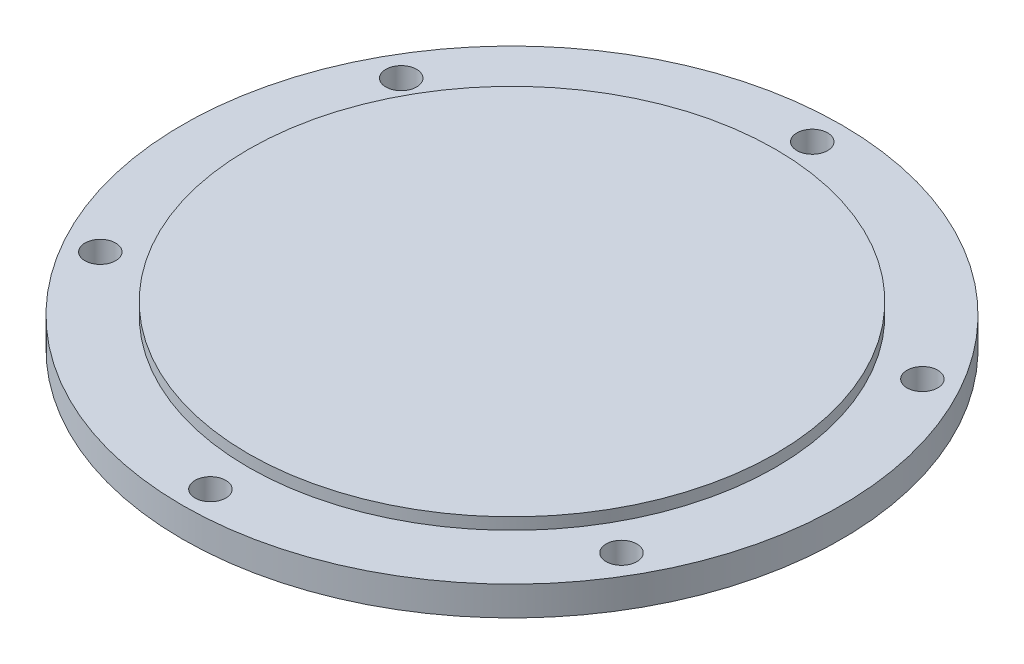
from build123d import *

# Parameters (mm, degrees)
CROQUIS1_R              = 112.5
SALIENTE_EXTRUIR1_DEPTH = 10
MATRIZC1_COUNT          = 6
CROQUIS6_R              = 90
SALIENTE_EXTRUIR2_DEPTH = 4


with BuildPart() as part:
    # Croquis1 → Saliente-Extruir1 (new body)
    with BuildSketch(Plane(origin=(0, 0, 0), x_dir=(1, 0, 0), z_dir=(0, 1, 0))):
        with Locations(Location((0, 0, 0), (0, 0, 270))):
            Circle(CROQUIS1_R)
    extrude(amount=SALIENTE_EXTRUIR1_DEPTH)

    # Croquis5 → Taladro roscado M12x1.51 (revolve, cut)
    with BuildSketch(Plane(origin=(0, 10, -102.5), x_dir=(0, 0, 1), z_dir=(1, 0, 0))):
        Polygon((0, 0), (0, 34.65451825), (5.25, 31.5), (5.25, 0), align=None)
    taladro_roscado_m12x1_51 = revolve(axis=Axis((0, 16.35, -102.5), (0, -1, 0)), mode=Mode.SUBTRACT)

    # MatrizC1: Taladro roscado M12x1.51 ×6 about axis
    matrizc1_axis = Axis((0, 0, 0.223709412), (0, 1, 0))
    for i in range(1, MATRIZC1_COUNT):
        add(taladro_roscado_m12x1_51.rotate(matrizc1_axis, i * 360 / MATRIZC1_COUNT), mode=Mode.SUBTRACT)

    # Croquis6 → Saliente-Extruir2 (add)
    with BuildSketch(Plane(origin=(0, 10, 0), x_dir=(1, 0, 0), z_dir=(0, 1, 0))):
        with Locations(Location((0, 0, 0), (0, 0, 270))):
            Circle(CROQUIS6_R)
    extrude(amount=SALIENTE_EXTRUIR2_DEPTH)


solid = part.part
